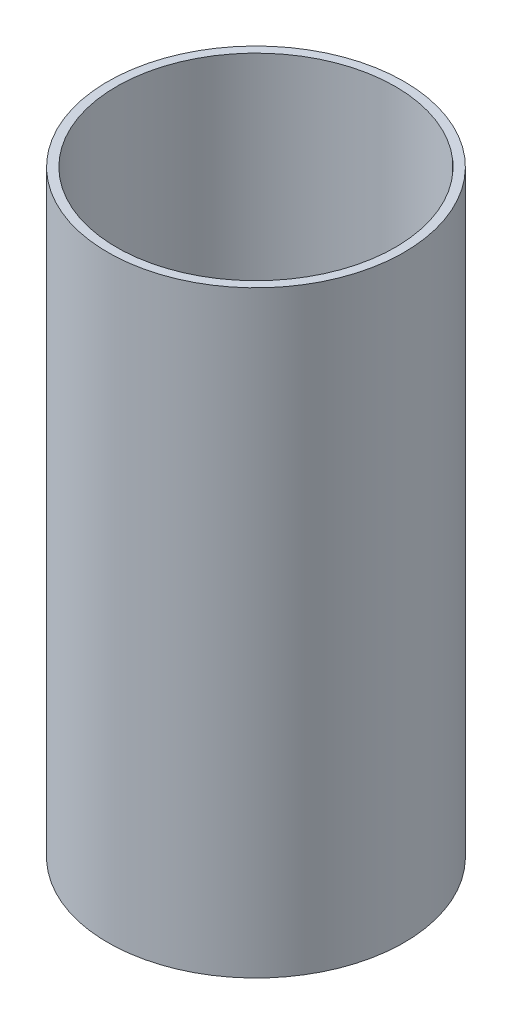
from build123d import *

# Parameters (mm, degrees)
SKETCH1_W = 1.5875
SKETCH1_H = 108.931601554


with BuildPart() as part:
    # Sketch1 → Revolve1 (revolve)
    with BuildSketch(Plane.XY, mode=Mode.PRIVATE) as revolve1_sk:
        with Locations((26.19375, -47.428195303)):
            Rectangle(SKETCH1_W, SKETCH1_H)
    revolve(revolve1_sk.sketch.rotate(Axis((0, 0, 0), (0, 1, 0)), 90), axis=Axis((0, 0, 0), (0, 1, 0)))


solid = part.part
